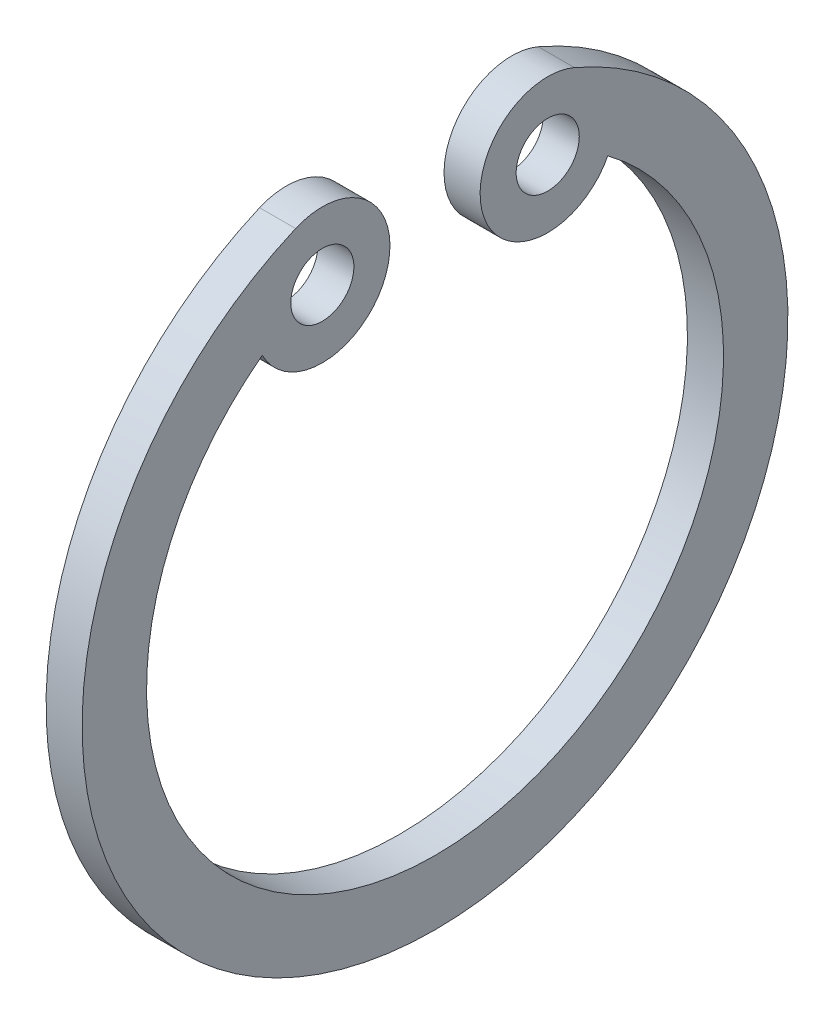
from build123d import *

# Parameters (mm, degrees)
SKETCH1_R           = 0.7
BOSS_EXTRUDE1_DEPTH = 0.8


with BuildPart() as part:
    # Sketch1 → Boss-Extrude1 (new body)
    with BuildSketch(Plane(origin=(0, 0, 0), x_dir=(0, 0, -1), z_dir=(1, 0, 0))):
        with BuildLine():
            ThreePointArc((3.228042319, 12.609235821), (1.223335432, 10.725526511), (3.968101377, 10.542577405))
            ThreePointArc((3.968101377, 10.542577405), (0.135522118, -0.982979757), (-3.697057141, 10.542577405))
            ThreePointArc((-3.697057141, 10.542577405), (-0.952291196, 10.725526511), (-2.956998083, 12.609235821))
            ThreePointArc((-2.956998083, 12.609235821), (0.135522118, -2.4118779), (3.228042319, 12.609235821))
        make_face()
        with Locations((2.635522118, 11.231222828)):
            Circle(SKETCH1_R, mode=Mode.SUBTRACT)
        with Locations(Location((-2.364477882, 11.231222828, 0), (0, 0, 180))):
            Circle(SKETCH1_R, mode=Mode.SUBTRACT)
    extrude(amount=BOSS_EXTRUDE1_DEPTH)


solid = part.part
